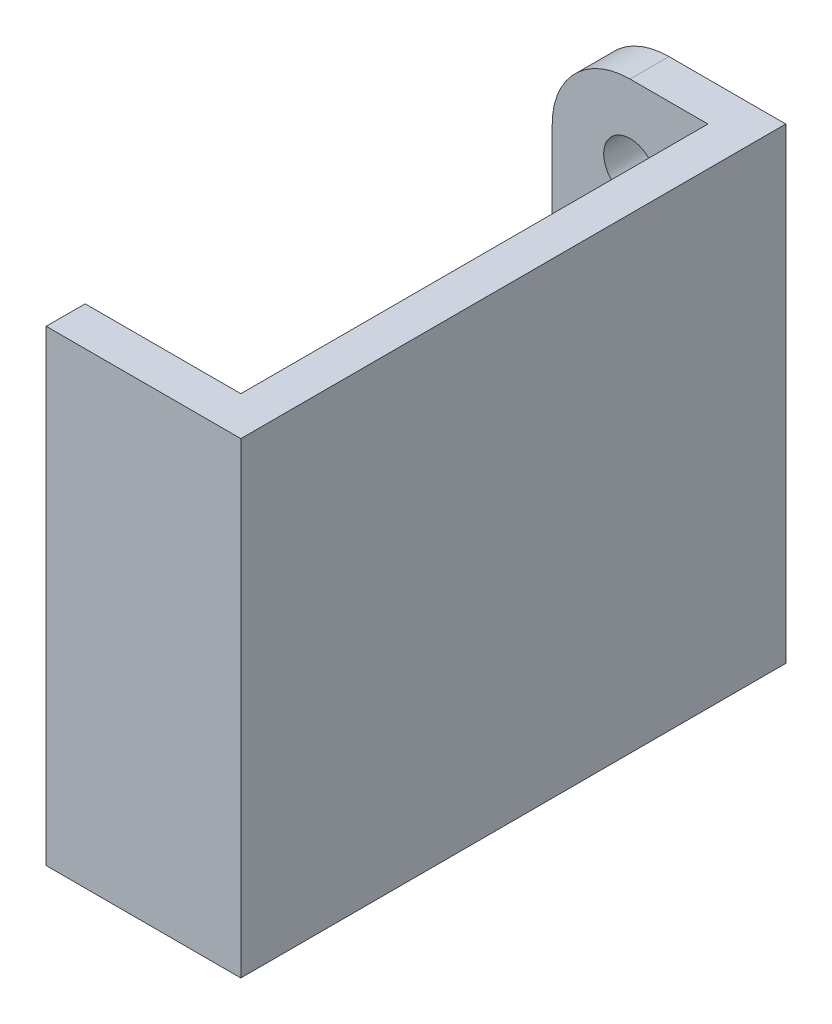
from build123d import *

# Parameters (mm, degrees)
SKETCH1_W           = 15.875
SKETCH1_H           = 38.1
BOSS_EXTRUDE1_DEPTH = 44.45
SHELL1_T            = -3.175
CUT_EXTRUDE1_REACH  = 48.147
SKETCH2_R           = 2.15265
FILLET2_R           = 6.35


with BuildPart() as part:
    # Sketch1 → Boss-Extrude1 (new body)
    with BuildSketch(Plane.XY):
        Rectangle(SKETCH1_W, SKETCH1_H)
    extrude(amount=-BOSS_EXTRUDE1_DEPTH)

    # Shell1
    shell1_openings = [part.faces().sort_by_distance(p)[0] for p in [
        (-7.9375, 0, -22.225),
        (0, 19.05, -22.225),
    ]]
    offset(amount=SHELL1_T, openings=shell1_openings, kind=Kind.INTERSECTION)

    # Sketch2 → Cut-Extrude1 (cut, up to next)
    with BuildSketch(Plane.XY.offset(-3.175), mode=Mode.PRIVATE) as cut_extrude1_sk1:
        with Locations((-1.5875, -6.35)):
            Circle(SKETCH2_R)
    cut_extrude1_tool1 = extrude(cut_extrude1_sk1.sketch, amount=-CUT_EXTRUDE1_REACH, mode=Mode.PRIVATE) & part.part
    # Sketch2 → Cut-Extrude1 (cut, up to next)
    with BuildSketch(Plane.XY.offset(-3.175), mode=Mode.PRIVATE) as cut_extrude1_sk2:
        with Locations((-1.5875, 12.7)):
            Circle(SKETCH2_R)
    cut_extrude1_tool2 = extrude(cut_extrude1_sk2.sketch, amount=-CUT_EXTRUDE1_REACH, mode=Mode.PRIVATE) & part.part
    add(cut_extrude1_tool1.solids().sort_by_distance((-1.5875, -6.35, -3.175))[0], mode=Mode.SUBTRACT)
    add(cut_extrude1_tool2.solids().sort_by_distance((-1.5875, 12.7, -3.175))[0], mode=Mode.SUBTRACT)

    # Fillet2
    fillet2_edges = [part.edges().sort_by_distance(p)[0] for p in [
        (-7.9375, 19.05, -42.8625),
    ]]
    fillet(fillet2_edges, radius=FILLET2_R)


solid = part.part
